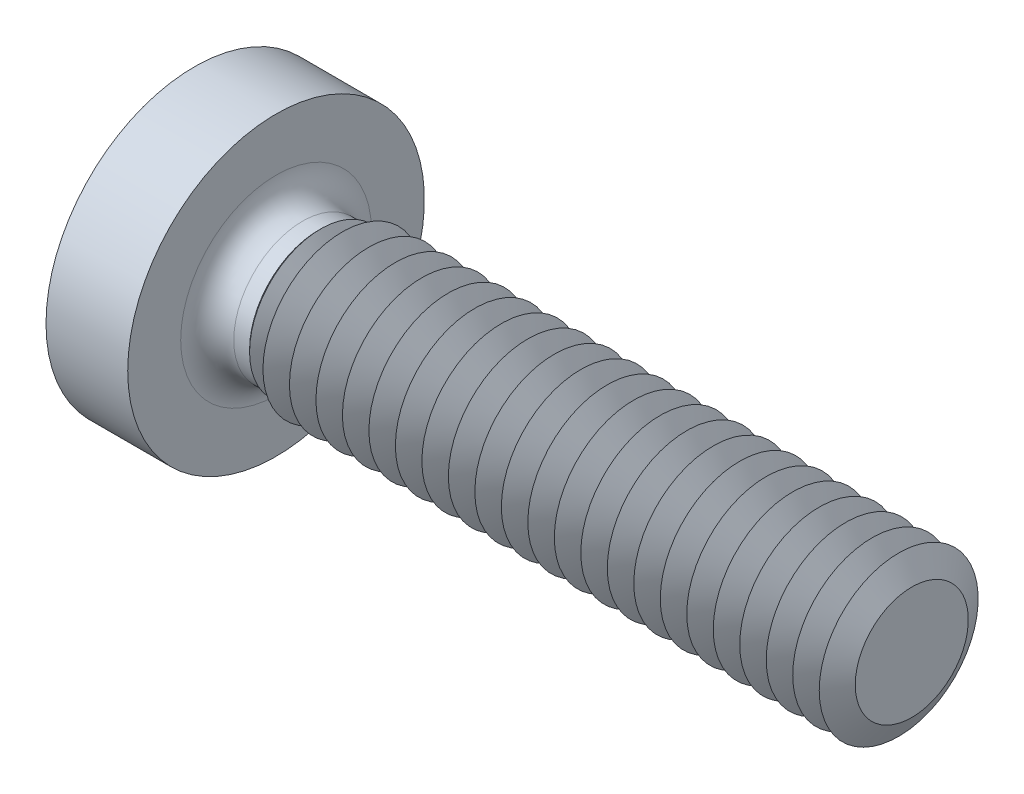
from build123d import *

# Parameters (mm, degrees)
PATTERN_LINEAR_1_COUNT = 23
PATTERN_LINEAR_1_PITCH = 0.5


with BuildPart() as part:
    # 草图2 → Revolve 706 (revolve)
    with BuildSketch(Plane.XY, mode=Mode.PRIVATE) as revolve_706_sk:
        with BuildLine():
            Line((0, 0), (14.4, 0))
            Line((14.4, 0), (14.4, 1.5))
            Line((14.4, 1.5), (3.4, 1.5))
            Line((3.4, 1.5), (3.199, 1.299))
            Line((3.199, 1.299), (2.901, 1.299))
            ThreePointArc((2.901, 1.299), (2.546739503, 1.445739503), (2.4, 1.8))
            Line((2.4, 1.8), (2.4, 2.8))
            Line((2.4, 2.8), (0.857536965, 2.8))
            ThreePointArc((0.857536965, 2.8), (0.219188606, 1.464186604), (0, 0))
        make_face()
    revolve(revolve_706_sk.sketch.rotate(Axis((-1.331757704, 0, 0), (1, 0, 0)), 90), axis=Axis((-1.331757704, 0, 0), (1, 0, 0)))

    # 草图3 → 切除-旋转1 (revolve, cut)
    with BuildSketch(Plane.XY, mode=Mode.PRIVATE) as cut_revolve_1_sk:
        Polygon((14.152708003, 1.5), (14.652708003, 1.5), (14.4, 1.067), align=None)
    cut_revolve_1 = revolve(cut_revolve_1_sk.sketch.rotate(Axis((-0.242766179, 0, 0), (1, 0, 0)), 90), axis=Axis((-0.242766179, 0, 0), (1, 0, 0)), mode=Mode.SUBTRACT)

    # 阵列(线性)1: 切除-旋转1 ×23
    with Locations(*[(-i * PATTERN_LINEAR_1_PITCH, 0, 0) for i in range(1, PATTERN_LINEAR_1_COUNT)]):
        add(cut_revolve_1, mode=Mode.SUBTRACT)

    # 草图5 → 切除-放样1 section 0
    with BuildSketch(Plane(origin=(0, 0, 0), x_dir=(0, 0, -1), z_dir=(1, 0, 0)), mode=Mode.PRIVATE) as loft_1_s0:
        with BuildLine():
            Line((0.25, 1.5), (-0.25, 1.5))
            Line((-0.25, 1.5), (-0.25, -1.5))
            Line((-0.25, -1.5), (0.25, -1.5))
            Line((0.25, -1.5), (0.25, 1.5))
        make_face()
    loft_1 = loft([Vertex(1.8, 0, 0), loft_1_s0.sketch], mode=Mode.SUBTRACT)

    # 镜向1: 切除-放样1 across plane
    add(loft_1.mirror(Plane(origin=(0, 0, 0), x_dir=(0, 0.7071067811865462, 0.7071067811865488), z_dir=(0, -0.7071067811865488, 0.7071067811865462))), mode=Mode.SUBTRACT)


solid = part.part
